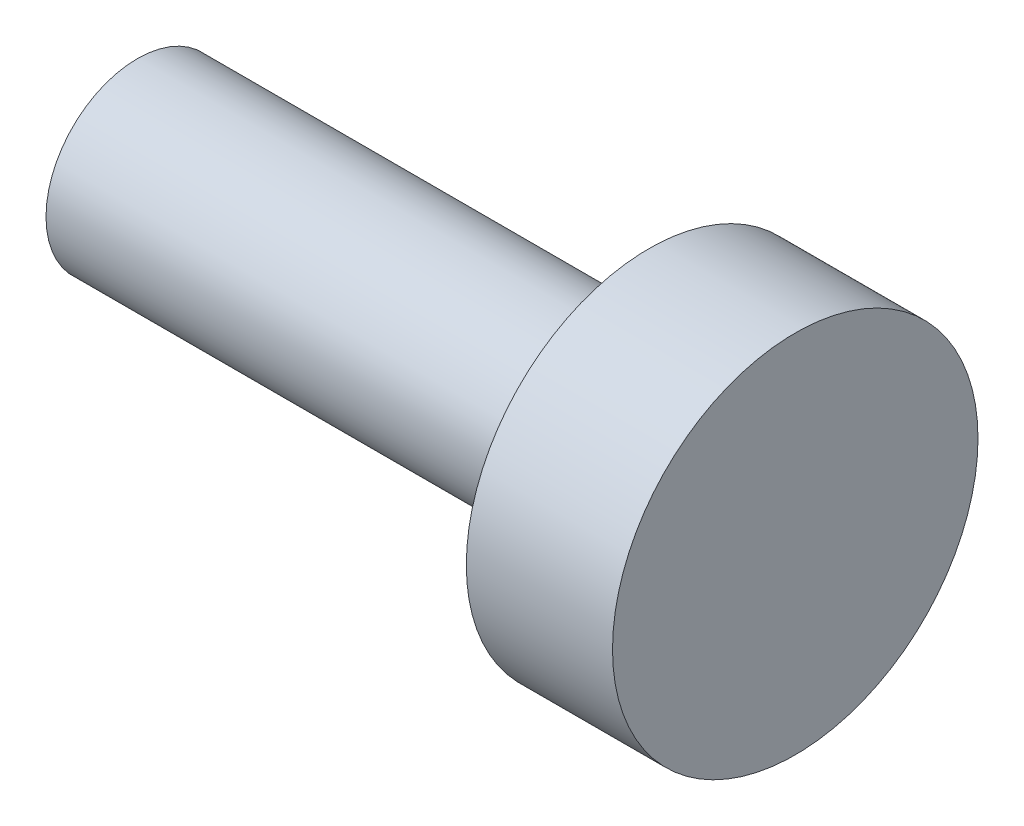
from build123d import *


with BuildPart() as part:
    # Sketch1 → Revolve1 (revolve)
    with BuildSketch(Plane.XY, mode=Mode.PRIVATE) as revolve1_sk:
        Polygon((0, 0), (22.86, 0), (22.86, 6.35), (17.78, 6.35), (17.78, 3.175), (0, 3.175), align=None)
    revolve(revolve1_sk.sketch.rotate(Axis((0, 0, 0), (1, 0, 0)), 90), axis=Axis((0, 0, 0), (1, 0, 0)))


solid = part.part
